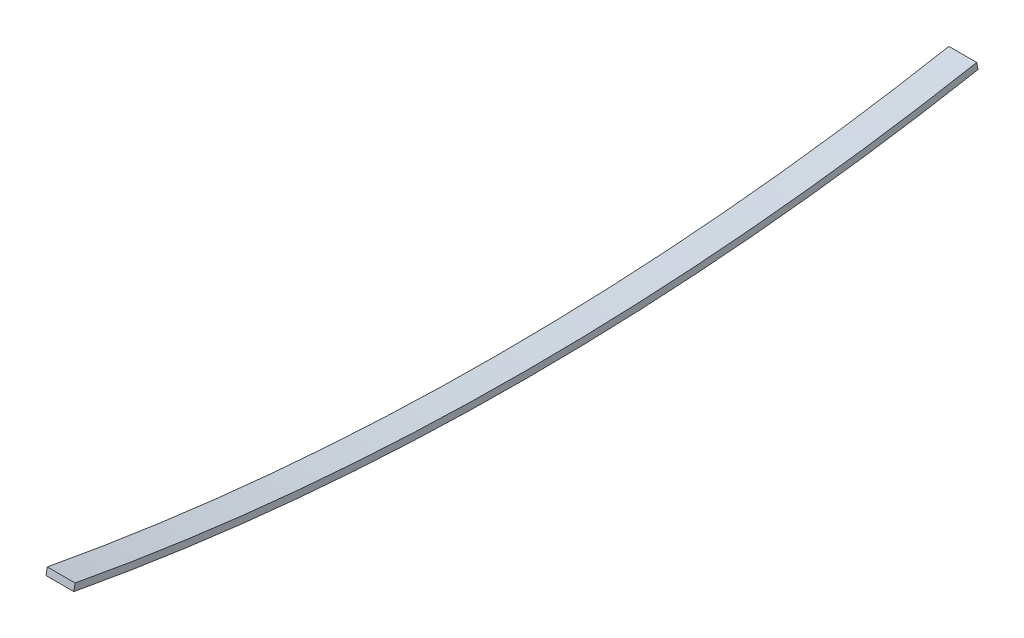
from build123d import *

# Parameters (mm, degrees)
EXTRUDE_THIN1_DEPTH = 2


with BuildPart() as part:
    # Sketch1 → Extrude-Thin1 (new body)
    with BuildSketch(Plane(origin=(0, 0, 0), x_dir=(0, 0, -1), z_dir=(1, 0, 0))):
        with BuildLine():
            ThreePointArc((-32.5, 1.5), (0, -1.5), (32.5, 1.5))
            Line((32.5, 1.5), (32.40847219, 1.991551279))
            ThreePointArc((32.40847219, 1.991551279), (0, -1), (-32.40847219, 1.991551279))
            Line((-32.40847219, 1.991551279), (-32.5, 1.5))
        make_face()
    extrude(amount=EXTRUDE_THIN1_DEPTH)


solid = part.part
